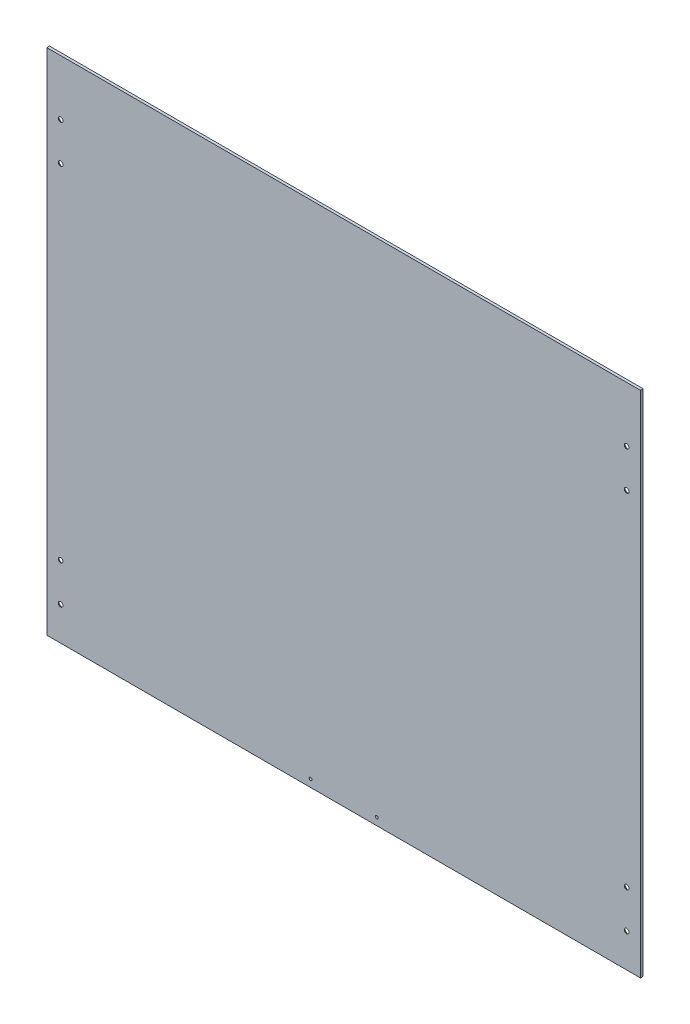
from build123d import *

# Parameters (mm, degrees)
SKETCH1_W                    = 700
SKETCH1_H                    = 600
EXTRUDE1_DEPTH               = 1.5875
CSK_FOR_M5_SFHCS2_AT_2_COUNT = 2
CSK_FOR_M5_SFHCS2_AT_2_PITCH = 45
CSK_FOR_M5_SFHCS2_AT_3_COUNT = 2
CSK_FOR_M5_SFHCS2_AT_3_PITCH = 450
CSK_FOR_M5_SFHCS2_AT_4_COUNT = 2
CSK_FOR_M5_SFHCS2_AT_4_PITCH = 495
CSK_FOR_M5_SFHCS2_AT_5_COUNT = 2
CSK_FOR_M5_SFHCS2_AT_5_PITCH = 830.851545103
CSK_FOR_M5_SFHCS2_AT_6_COUNT = 2
CSK_FOR_M5_SFHCS2_AT_6_PITCH = 804.853582958
CSK_FOR_M5_SFHCS2_AT_7_COUNT = 2
CSK_FOR_M5_SFHCS2_AT_7_PITCH = 668.815587438
CSK_FOR_M5_SFHCS2_AT_8_COUNT = 2
CSK_FOR_M5_SFHCS2_AT_8_PITCH = 667.3
M4X0_7_TAPPED_HOLE1_D        = 3.3


with BuildPart() as part:
    # Sketch1 → Extrude1 (new, symmetric)
    with BuildSketch(Plane.XY):
        Rectangle(SKETCH1_W, SKETCH1_H)
    extrude(amount=EXTRUDE1_DEPTH, both=True)

    # Sketch4 → CSK for M5 SFHCS2 (revolve, cut)
    with BuildSketch(Plane(origin=(333.65, 234.7, -1.5875), x_dir=(0, 1, 0), z_dir=(1, 0, 0))):
        Polygon((0, 0), (0, 3.175), (2.75, 3.175), (2.75, 3), (5.75, 0), align=None)
    csk_for_m5_sfhcs2 = revolve(axis=Axis((333.65, 234.7, -7.9375), (0, 0, 1)), mode=Mode.SUBTRACT)

    # CSK for M5 SFHCS2 at 2: CSK for M5 SFHCS2 ×2
    with Locations(*[(0, -i * CSK_FOR_M5_SFHCS2_AT_2_PITCH, 0) for i in range(1, CSK_FOR_M5_SFHCS2_AT_2_COUNT)]):
        add(csk_for_m5_sfhcs2, mode=Mode.SUBTRACT)

    # CSK for M5 SFHCS2 at 3: CSK for M5 SFHCS2 ×2
    with Locations(*[(0, -i * CSK_FOR_M5_SFHCS2_AT_3_PITCH, 0) for i in range(1, CSK_FOR_M5_SFHCS2_AT_3_COUNT)]):
        add(csk_for_m5_sfhcs2, mode=Mode.SUBTRACT)

    # CSK for M5 SFHCS2 at 4: CSK for M5 SFHCS2 ×2
    with Locations(*[(0, -i * CSK_FOR_M5_SFHCS2_AT_4_PITCH, 0) for i in range(1, CSK_FOR_M5_SFHCS2_AT_4_COUNT)]):
        add(csk_for_m5_sfhcs2, mode=Mode.SUBTRACT)

    # CSK for M5 SFHCS2 at 5: CSK for M5 SFHCS2 ×2
    with Locations(*[Vector(-0.8031519035296442, -0.5957743027831169, 0) * (i * CSK_FOR_M5_SFHCS2_AT_5_PITCH) for i in range(1, CSK_FOR_M5_SFHCS2_AT_5_COUNT)]):
        add(csk_for_m5_sfhcs2, mode=Mode.SUBTRACT)

    # CSK for M5 SFHCS2 at 6: CSK for M5 SFHCS2 ×2
    with Locations(*[Vector(-0.8290948989103177, -0.5591079042554219, 0) * (i * CSK_FOR_M5_SFHCS2_AT_6_PITCH) for i in range(1, CSK_FOR_M5_SFHCS2_AT_6_COUNT)]):
        add(csk_for_m5_sfhcs2, mode=Mode.SUBTRACT)

    # CSK for M5 SFHCS2 at 7: CSK for M5 SFHCS2 ×2
    with Locations(*[Vector(-0.9977339232720667, -0.06728312085605138, 0) * (i * CSK_FOR_M5_SFHCS2_AT_7_PITCH) for i in range(1, CSK_FOR_M5_SFHCS2_AT_7_COUNT)]):
        add(csk_for_m5_sfhcs2, mode=Mode.SUBTRACT)

    # CSK for M5 SFHCS2 at 8: CSK for M5 SFHCS2 ×2
    with Locations(*[(-i * CSK_FOR_M5_SFHCS2_AT_8_PITCH, 0, 0) for i in range(1, CSK_FOR_M5_SFHCS2_AT_8_COUNT)]):
        add(csk_for_m5_sfhcs2, mode=Mode.SUBTRACT)

    # M4x0.7 Tapped Hole1 (through all)
    with Locations(Plane.XY.offset(1.5875)):
        with Locations((-39, -291.25), (39, -291.25)):
            Hole(M4X0_7_TAPPED_HOLE1_D / 2)


solid = part.part
